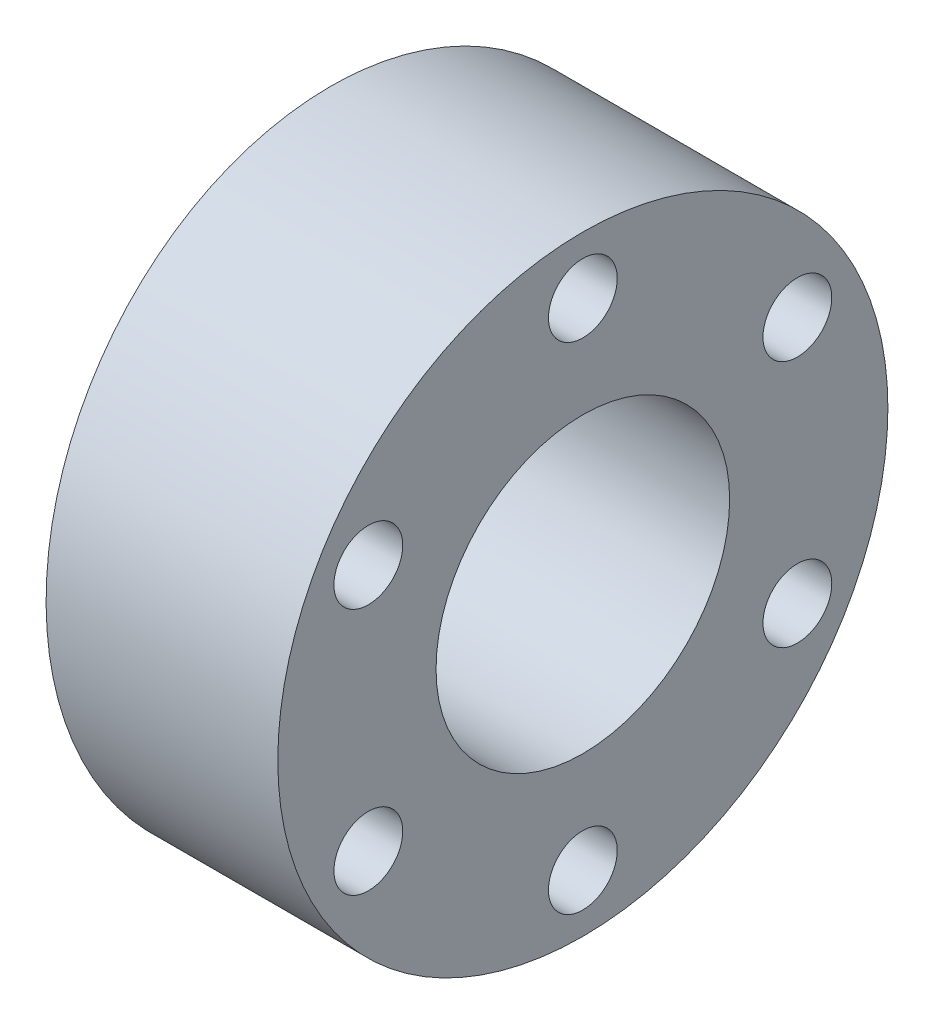
from build123d import *

# Parameters (mm, degrees)
SKETCH1_R               = 16.891
BOSS_EXTRUDE1_DEPTH     = 13.97
SKETCH2_R               = 8.128
CUT_EXTRUDE1_DEPTH      = 28.672597674
CUT_EXTRUDE2_DEPTH      = 28.672597674
CUT_EXTRUDE2_DEPTH_BACK = 28.672597674
SKETCH7_R               = 1.905
CUT_EXTRUDE3_DEPTH      = 28.672597674
CIRPATTERN1_COUNT       = 6


with BuildPart() as part:
    # Sketch1 → Boss-Extrude1 (new body)
    with BuildSketch(Plane(origin=(0, 0, 0), x_dir=(0, 0, -1), z_dir=(1, 0, 0))):
        Circle(SKETCH1_R)
    extrude(amount=BOSS_EXTRUDE1_DEPTH)

    # Sketch2 → Cut-Extrude1 (cut, through all)
    with BuildSketch(Plane(origin=(13.97, 0, 0), x_dir=(0, 0, -1), z_dir=(1, 0, 0))):
        Circle(SKETCH2_R)
    extrude(amount=-CUT_EXTRUDE1_DEPTH, mode=Mode.SUBTRACT)

    # Sketch3 → Cut-Extrude2 (cut, two sides: drawn at the far end of the back side and taken through both)
    with BuildSketch(Plane.XY.offset(-CUT_EXTRUDE2_DEPTH_BACK)):
        Polygon((0, 16.891), (2.362267561, -16.891), (0, -16.891), align=None)
    extrude(amount=CUT_EXTRUDE2_DEPTH + CUT_EXTRUDE2_DEPTH_BACK, mode=Mode.SUBTRACT)

    # Sketch7 → Cut-Extrude3 (cut, through all)
    with BuildSketch(Plane(origin=(13.97, 0, 0), x_dir=(0, 0, -1), z_dir=(1, 0, 0))):
        with Locations((0, 13.716)):
            Circle(SKETCH7_R)
    cut_extrude3 = extrude(amount=-CUT_EXTRUDE3_DEPTH, mode=Mode.SUBTRACT)

    # CirPattern1: Cut-Extrude3 ×6 about axis
    cirpattern1_axis = Axis((0, 0, 0), (1, 0, 0))
    for i in range(1, CIRPATTERN1_COUNT):
        add(cut_extrude3.rotate(cirpattern1_axis, i * 360 / CIRPATTERN1_COUNT), mode=Mode.SUBTRACT)


solid = part.part
